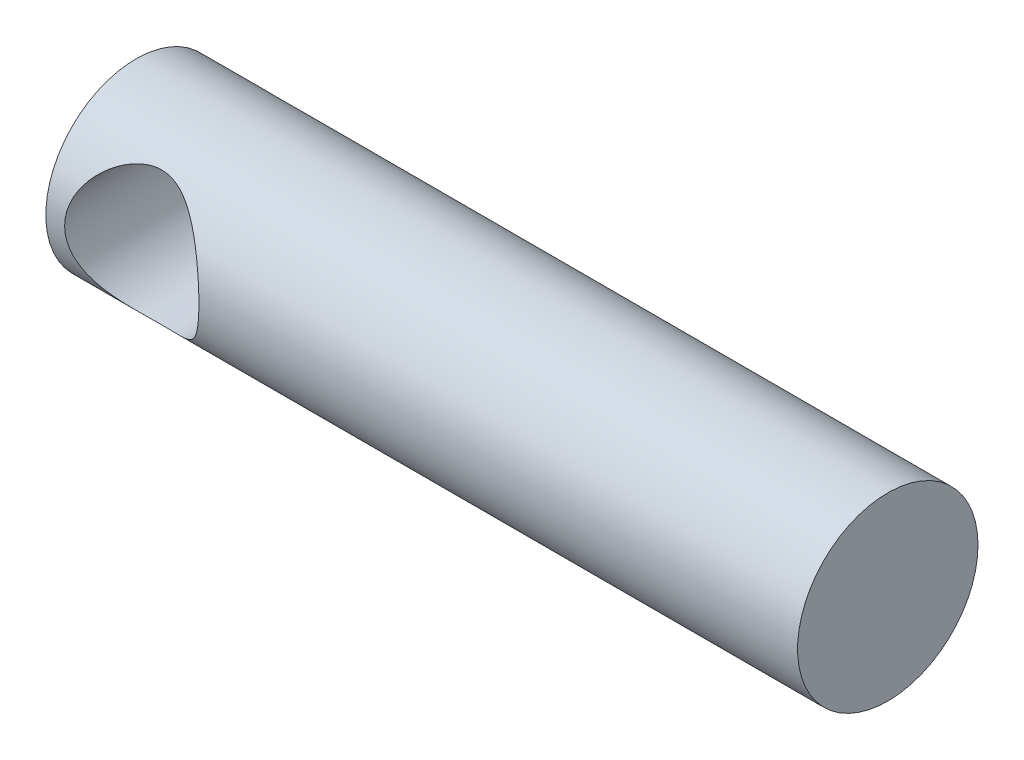
from build123d import *

# Parameters (mm, degrees)
SKETCH1_R               = 10.668
BOSS_EXTRUDE1_DEPTH     = 88.9
CUT_EXTRUDE2_DEPTH      = 91.171073233
CUT_EXTRUDE2_DEPTH_BACK = 91.171073233
SKETCH2_R               = 7.9375


with BuildPart() as part:
    # Sketch1 → Boss-Extrude1 (new body)
    with BuildSketch(Plane(origin=(0, 0, 0), x_dir=(0, 0, -1), z_dir=(1, 0, 0))):
        Circle(SKETCH1_R)
    extrude(amount=BOSS_EXTRUDE1_DEPTH)

    # Sketch2 → Cut-Extrude2 (cut, two sides: drawn at the far end of the back side and taken through both)
    with BuildSketch(Plane.XY.offset(-CUT_EXTRUDE2_DEPTH_BACK)):
        with Locations((10.16, 0)):
            Circle(SKETCH2_R)
    extrude(amount=CUT_EXTRUDE2_DEPTH + CUT_EXTRUDE2_DEPTH_BACK, mode=Mode.SUBTRACT)


solid = part.part
